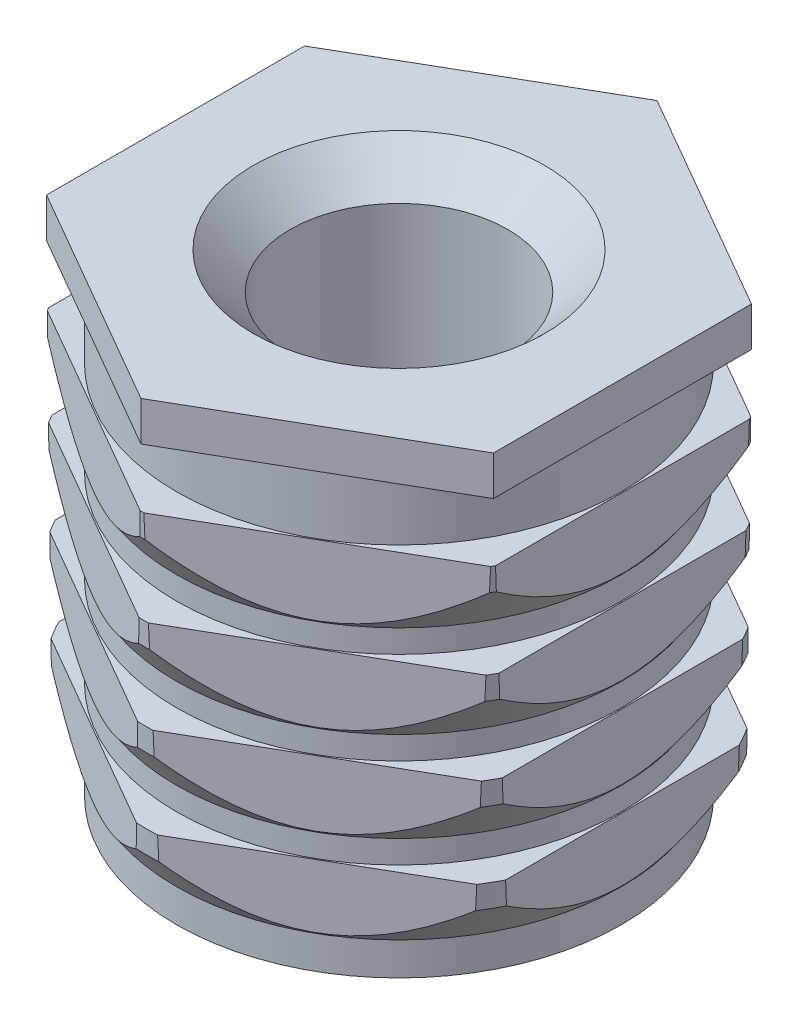
from build123d import *

# Parameters (mm, degrees)
EXTRUDE1_DEPTH = 6.73
SKETCH4_R      = 1.545336663
EXTRUDE2_DEPTH = 9.295442022
CHAMFER1_SIZE  = 0.525


with BuildPart() as part:
    # Sketch1 → Extrude1 (new body)
    with BuildSketch(Plane(origin=(0, 0, 0), x_dir=(1, 0, 0), z_dir=(0, 1, 0))):
        Polygon((0, 3.666174209), (-3.175, 1.833087105), (-3.175, -1.833087105), (0, -3.666174209), (3.175, -1.833087105), (3.175, 1.833087105), align=None)
    extrude(amount=-EXTRUDE1_DEPTH)

    # Sketch4 → Extrude2 (cut, through all)
    with BuildSketch(Plane(origin=(0, 0, 0), x_dir=(-1, 0, 0), z_dir=(0, 1, 0))):
        Circle(SKETCH4_R)
    extrude(amount=-EXTRUDE2_DEPTH, mode=Mode.SUBTRACT)

    # Chamfer1
    chamfer1_edges = [part.edges().sort_by_distance(p)[0] for p in [
        (1.545336663, 0, 0),
        (1.545336663, -6.73, 0),
    ]]
    chamfer(chamfer1_edges, length=CHAMFER1_SIZE)

    # Sketch5 → Cut-Revolve1 (revolve, cut)
    with BuildSketch(Plane.XY):
        Polygon((-3.16, -6.73), (-3.666174209, -6.73), (-4.172348419, -6.73), (-4.172348419, 0), (-3.666174209, 0), (-3.666174209, -0.560833333), (-3.16, -0.560833333), (-3.16, -1.402083333), (-3.651490136, -1.402083333), (-3.645798403, -1.728162487), (-3.16, -2.421954508), (-3.16, -2.748083333), (-3.627995619, -2.748083333), (-3.622303886, -3.074162487), (-3.16, -3.73440086), (-3.16, -4.060529685), (-3.605086782, -4.060529685), (-3.59939505, -4.386608839), (-3.16, -5.014130003), (-3.16, -5.340258828), (-3.582749027, -5.340258828), (-3.577057294, -5.666337982), (-3.16, -6.261957525), align=None)
    revolve(axis=Axis((0, 0, 0), (0, -1, 0)), mode=Mode.SUBTRACT)


solid = part.part
